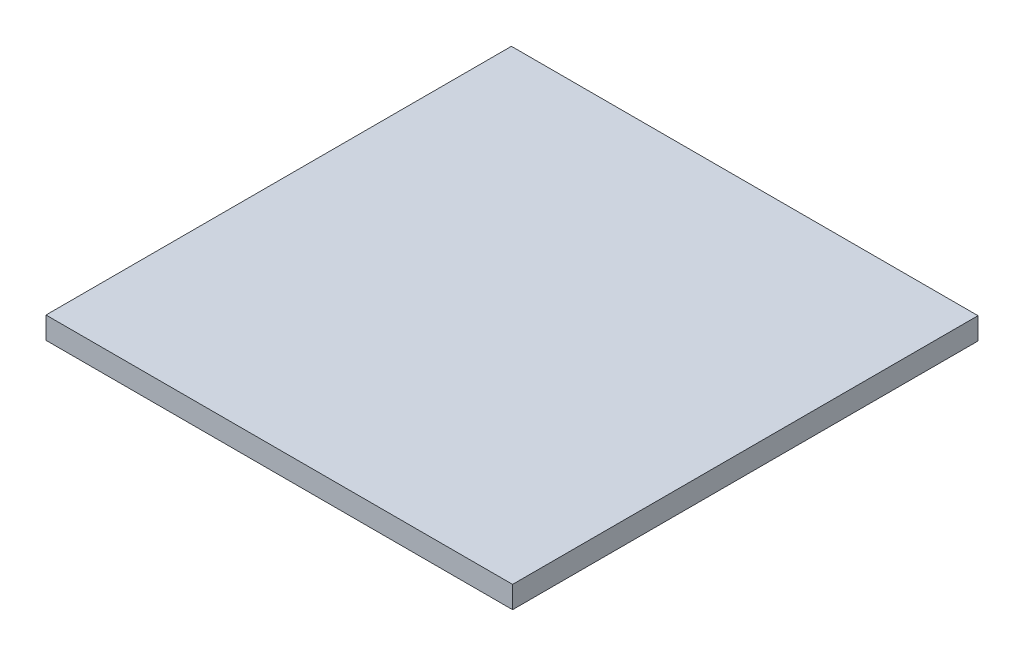
from build123d import *

# Parameters (mm, degrees)
SKETCH1_W           = 637.6
SKETCH1_H           = 636
BOSS_EXTRUDE1_DEPTH = 30


with BuildPart() as part:
    # Sketch1 → Boss-Extrude1 (new body)
    with BuildSketch(Plane(origin=(0, 0, 0), x_dir=(1, 0, 0), z_dir=(0, 1, 0))):
        with Locations((-318.8, 318)):
            Rectangle(SKETCH1_W, SKETCH1_H)
    extrude(amount=BOSS_EXTRUDE1_DEPTH)


solid = part.part
